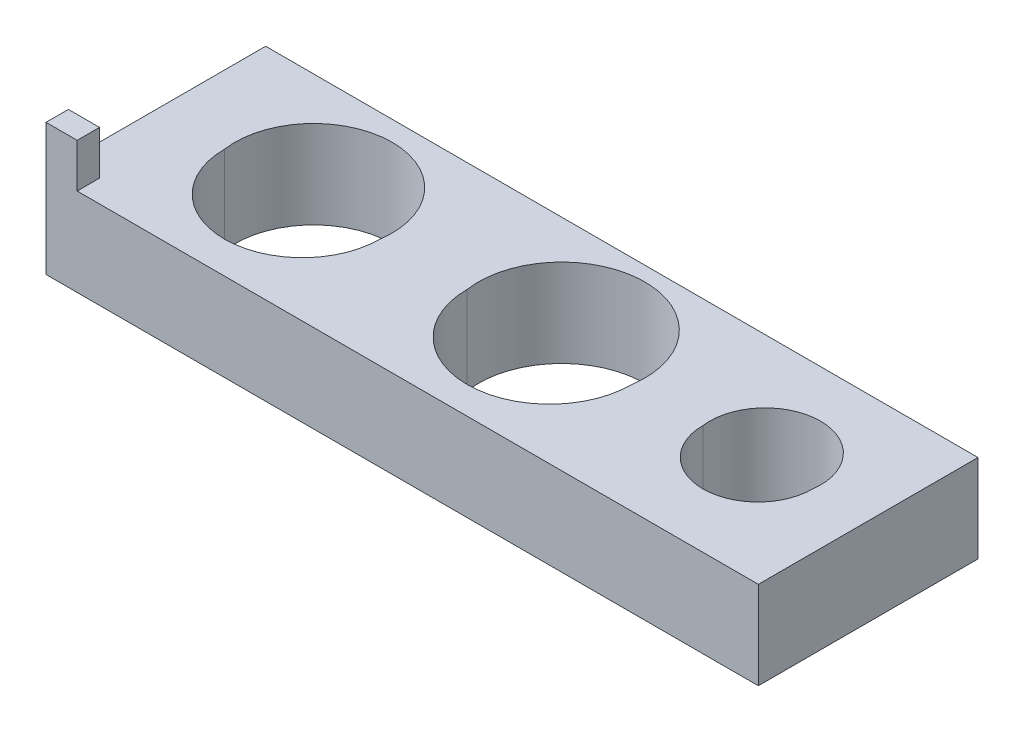
from build123d import *

# Parameters (mm, degrees)
SKETCH1_W           = 41.185763127
SKETCH1_H           = 12.7
BOSS_EXTRUDE1_DEPTH = 5.08
SKETCH3_W           = 1.801844016
SKETCH3_H           = 1.294077433
BOSS_EXTRUDE2_DEPTH = 2.54


with BuildPart() as part:
    # Sketch1 → Boss-Extrude1 (new body)
    with BuildSketch(Plane(origin=(0, 0, 0), x_dir=(1, 0, 0), z_dir=(0, 1, 0))):
        with Locations((17.507118437, 6.35)):
            Rectangle(SKETCH1_W, SKETCH1_H)
        with BuildLine():
            ThreePointArc((28.547464109, 6.35), (31.722464109, 9.968769047), (34.897464109, 6.35))
            ThreePointArc((34.897464109, 6.35), (31.722464109, 3.175), (28.547464109, 6.35))
        make_face(mode=Mode.SUBTRACT)
        with BuildLine():
            ThreePointArc((14.915366262, 6.35), (19.677866262, 11.860840795), (24.440366262, 6.35))
            ThreePointArc((24.440366262, 6.35), (19.677866262, 1.5875), (14.915366262, 6.35))
        make_face(mode=Mode.SUBTRACT)
        with BuildLine():
            ThreePointArc((0.879836225, 6.35), (5.379836225, 11.549994731), (9.879836225, 6.35))
            ThreePointArc((9.879836225, 6.35), (5.379836225, 1.85), (0.879836225, 6.35))
        make_face(mode=Mode.SUBTRACT)
    extrude(amount=BOSS_EXTRUDE1_DEPTH)

    # Sketch3 → Boss-Extrude2 (add)
    with BuildSketch(Plane(origin=(0, 5.08, 0), x_dir=(1, 0, 0), z_dir=(0, 1, 0))):
        with Locations((-2.184841119, 0.647038716)):
            Rectangle(SKETCH3_W, SKETCH3_H)
    extrude(amount=BOSS_EXTRUDE2_DEPTH)


solid = part.part
